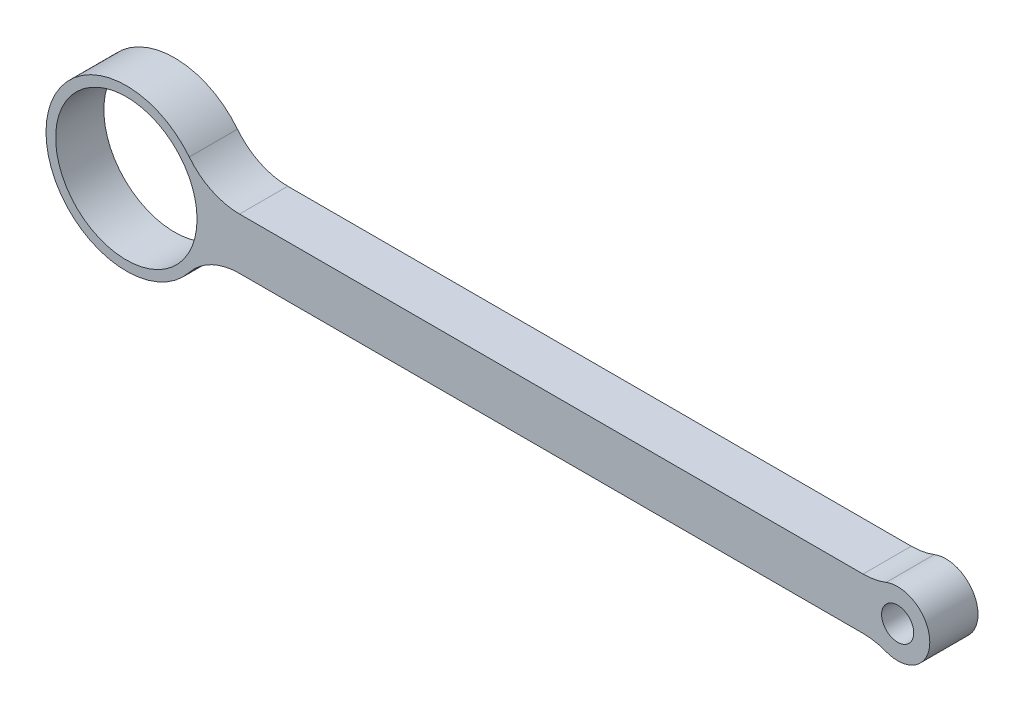
from build123d import *

# Parameters (mm, degrees)
SKETCH1_R           = 2.5
SKETCH1_R_2         = 11
BOSS_EXTRUDE1_DEPTH = 7.5
FILLET1_R           = 10


with BuildPart() as part:
    # Sketch1 → Boss-Extrude1 (new body)
    with BuildSketch(Plane.XY):
        with BuildLine():
            Line((57, 4), (-48.157280718, 4))
            ThreePointArc((-48.157280718, 4), (-72.5, 0), (-48.157280718, -4))
            Line((-48.157280718, -4), (57, -4))
            ThreePointArc((57, -4), (65, 0), (57, 4))
        make_face()
        with Locations((60, 0)):
            Circle(SKETCH1_R, mode=Mode.SUBTRACT)
        with Locations((-60, 0)):
            Circle(SKETCH1_R_2, mode=Mode.SUBTRACT)
    extrude(amount=BOSS_EXTRUDE1_DEPTH)

    # Fillet1
    fillet1_edges = [part.edges().sort_by_distance(p)[0] for p in [
        (57, 4, 3.75),
        (57, -4, 3.75),
        (-48.157280718, -4, 3.75),
        (-48.157280718, 4, 3.75),
    ]]
    fillet(fillet1_edges, radius=FILLET1_R)


solid = part.part
